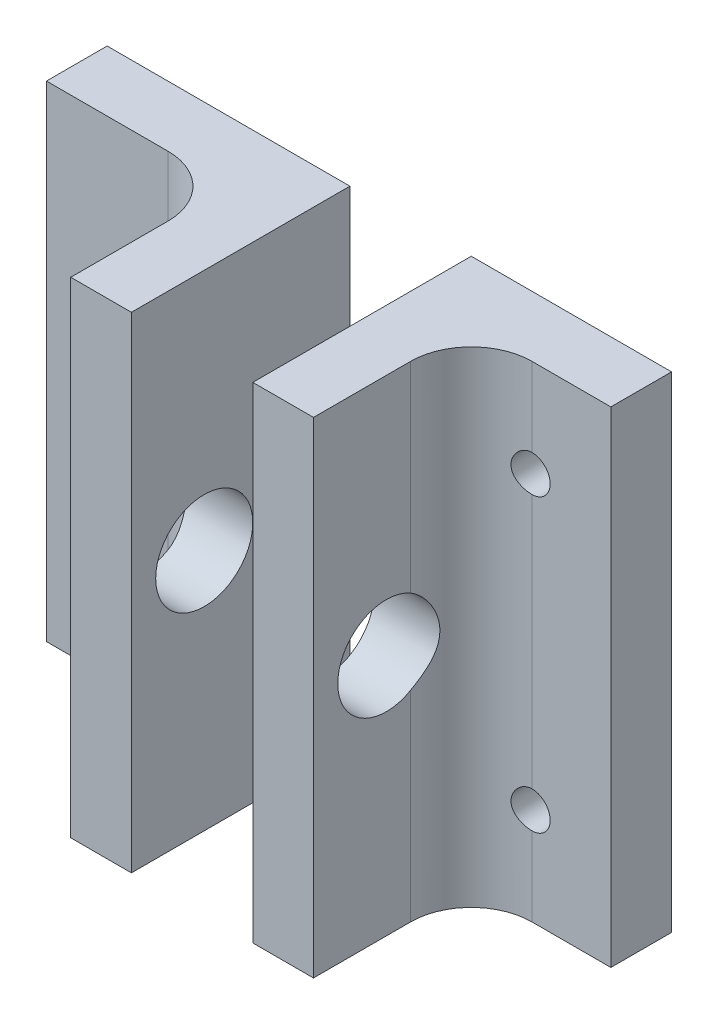
from build123d import *

# Parameters (mm, degrees)
BOSS_EXTRUDE1_DEPTH     = 20
BOSS_EXTRUDE1_2_DEPTH   = 20
CUT_EXTRUDE1_DEPTH      = 45.147480109
CUT_EXTRUDE1_DEPTH_BACK = 45.147480109
SKETCH2_R               = 4
CUT_EXTRUDE2_DEPTH      = 37.728735399
CUT_EXTRUDE2_DEPTH_BACK = 37.728735399
SKETCH3_R               = 1.5
CUT_EXTRUDE3_DEPTH      = 37.728735399
CUT_EXTRUDE3_DEPTH_BACK = 37.728735399
SKETCH4_W               = 3.5
SKETCH4_H               = 40


with BuildPart() as part:
    # Sketch1 → Boss-Extrude1 (new, symmetric)
    with BuildSketch(Plane(origin=(0, 0, 0), x_dir=(1, 0, 0), z_dir=(0, 1, 0))):
        with BuildLine():
            Line((-5, 18), (-5, 0))
            Line((-5, 0), (-10, 0))
            Line((-10, 0), (-10, 8))
            ThreePointArc((-10, 8), (-11.464466094, 11.535533906), (-15, 13))
            Line((-15, 13), (-25, 13))
            Line((-25, 13), (-25, 18))
            Line((-25, 18), (-5, 18))
        make_face()
    extrude(amount=BOSS_EXTRUDE1_DEPTH, both=True)


with BuildPart() as body_2:
    # Sketch1 → Boss-Extrude1 2 (new, symmetric)
    with BuildSketch(Plane(origin=(0, 0, 0), x_dir=(1, 0, 0), z_dir=(0, 1, 0))):
        with BuildLine():
            Line((25, 18), (5, 18))
            Line((5, 18), (5, 0))
            Line((5, 0), (10, 0))
            Line((10, 0), (10, 8))
            ThreePointArc((10, 8), (11.464466094, 11.535533906), (15, 13))
            Line((15, 13), (25, 13))
            Line((25, 13), (25, 18))
        make_face()
    extrude(amount=BOSS_EXTRUDE1_2_DEPTH, both=True)


with BuildPart() as cut_extrude1_tool:
    # Sketch2 → Cut-Extrude1 (new, two sides: drawn at the far end of the back side and taken through both)
    with BuildSketch(Plane(origin=(10, 0, 0), x_dir=(0, 0, -1), z_dir=(1, 0, 0)).offset(-CUT_EXTRUDE1_DEPTH_BACK)):
        with Locations((6, 0)):
            Circle(SKETCH2_R)
    extrude(amount=CUT_EXTRUDE1_DEPTH + CUT_EXTRUDE1_DEPTH_BACK)


with BuildPart() as part_1:
    add(part.part)

    # Cut-Extrude1: cut by cut_extrude1_tool
    add(cut_extrude1_tool.part, mode=Mode.SUBTRACT)


with BuildPart() as body_2_1:
    add(body_2.part)

    # Cut-Extrude1: cut by cut_extrude1_tool
    add(cut_extrude1_tool.part, mode=Mode.SUBTRACT)


with BuildPart() as cut_extrude2_tool:
    # Sketch3 → Cut-Extrude2 (new, two sides: drawn at the far end of the back side and taken through both)
    with BuildSketch(Plane(origin=(0, 0, -18), x_dir=(-1, 0, 0), z_dir=(0, 0, -1)).offset(-CUT_EXTRUDE2_DEPTH_BACK)):
        with Locations(Location((-15, -12, 0), (0, 0, 90))):
            Circle(SKETCH3_R)
        with Locations(Location((-15, 12, 0), (0, 0, 90))):
            Circle(SKETCH3_R)
        with Locations(Location((15, 12, 0), (0, 0, 90))):
            Circle(SKETCH3_R)
        with Locations(Location((15, -12, 0), (0, 0, 90))):
            Circle(SKETCH3_R)
    extrude(amount=CUT_EXTRUDE2_DEPTH + CUT_EXTRUDE2_DEPTH_BACK)


with BuildPart() as part_2:
    add(part_1.part)

    # Cut-Extrude2: cut by cut_extrude2_tool
    add(cut_extrude2_tool.part, mode=Mode.SUBTRACT)


with BuildPart() as body_2_2:
    add(body_2_1.part)

    # Cut-Extrude2: cut by cut_extrude2_tool
    add(cut_extrude2_tool.part, mode=Mode.SUBTRACT)

    # Sketch4 → Cut-Extrude3 (cut, two sides: drawn at the far end of the back side and taken through both)
    with BuildSketch(Plane(origin=(0, 0, -18), x_dir=(-1, 0, 0), z_dir=(0, 0, -1)).offset(-CUT_EXTRUDE3_DEPTH_BACK)):
        with Locations((-23.25, 0)):
            Rectangle(SKETCH4_W, SKETCH4_H)
    extrude(amount=CUT_EXTRUDE3_DEPTH + CUT_EXTRUDE3_DEPTH_BACK, mode=Mode.SUBTRACT)


solid = Compound([part_2.part, body_2_2.part])
